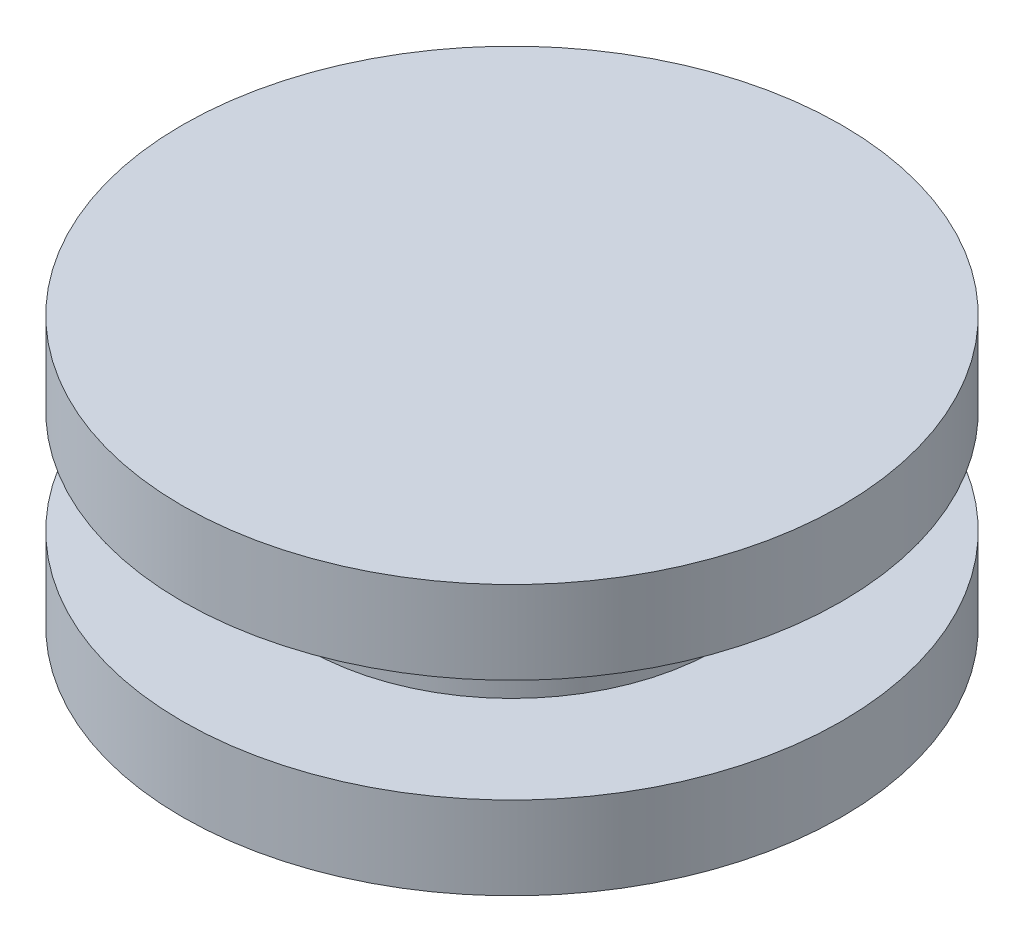
from build123d import *

# Parameters (mm, degrees)
SKETCH1_R           = 2.475
BOSS_EXTRUDE1_DEPTH = 0.625
SKETCH3_R           = 3.975
BOSS_EXTRUDE2_DEPTH = 1


with BuildPart() as part:
    # Sketch1 → Boss-Extrude1 (new, symmetric)
    with BuildSketch(Plane(origin=(0, 0, 0), x_dir=(1, 0, 0), z_dir=(0, 1, 0))):
        with Locations(Location((0, 0, 0), (0, 0, 270))):
            Circle(SKETCH1_R)
    extrude(amount=BOSS_EXTRUDE1_DEPTH, both=True)

    # Sketch3 → Boss-Extrude2 (add)
    with BuildSketch(Plane(origin=(0, 0.625, 0), x_dir=(1, 0, 0), z_dir=(0, 1, 0))):
        with Locations(Location((0, 0, 0), (0, 0, 270))):
            Circle(SKETCH3_R)
    boss_extrude2 = extrude(amount=BOSS_EXTRUDE2_DEPTH)

    # Mirror1: Boss-Extrude2 across plane
    add(boss_extrude2.mirror(Plane.ZX))


solid = part.part
